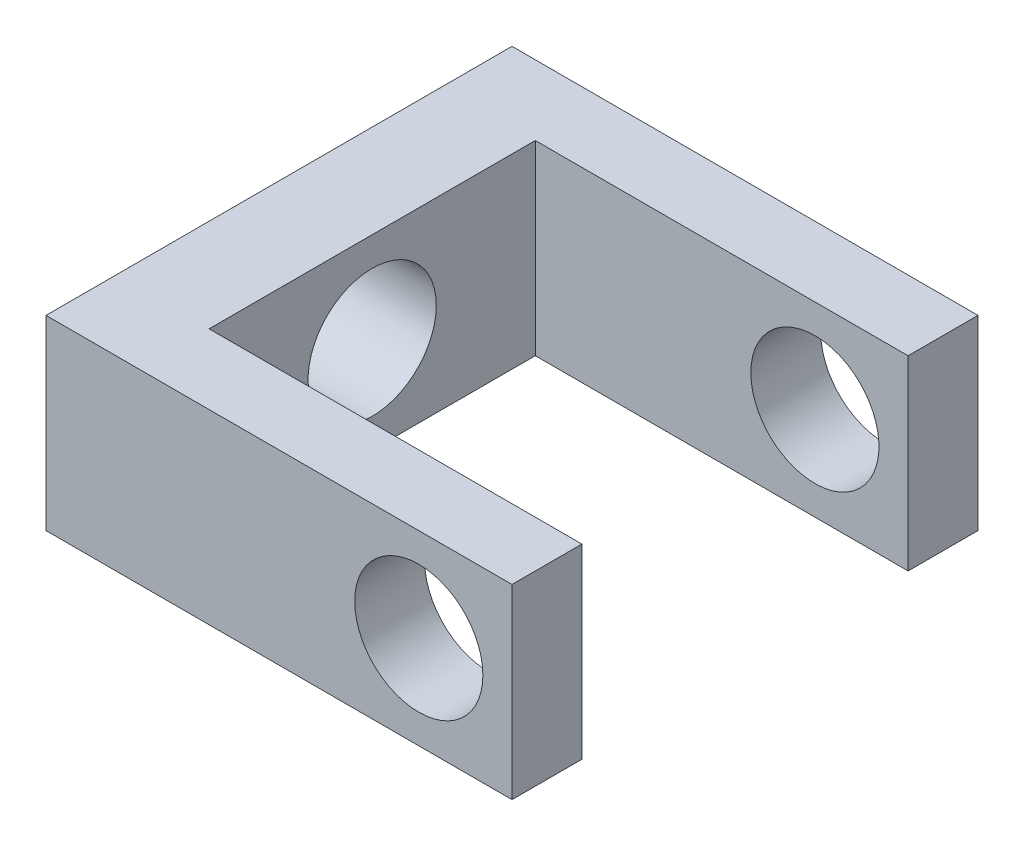
from build123d import *

# Parameters (mm, degrees)
SKETCH1_W           = 20
SKETCH1_H           = 8
SKETCH1_R           = 2.75
BOSS_EXTRUDE1_DEPTH = 20
SKETCH2_W           = 14
SKETCH2_H           = 8
CUT_EXTRUDE1_DEPTH  = 16
SKETCH3_R           = 2.75
CUT_EXTRUDE2_DEPTH  = 26.922962794


with BuildPart() as part:
    # Sketch1 → Boss-Extrude1 (new body)
    with BuildSketch(Plane.XY):
        Rectangle(SKETCH1_W, SKETCH1_H)
        with Locations((6, 0)):
            Circle(SKETCH1_R, mode=Mode.SUBTRACT)
    extrude(amount=BOSS_EXTRUDE1_DEPTH)

    # Sketch2 → Cut-Extrude1 (cut)
    with BuildSketch(Plane(origin=(10, 0, 0), x_dir=(0, 0, -1), z_dir=(1, 0, 0))):
        with Locations((-10, 0)):
            Rectangle(SKETCH2_W, SKETCH2_H)
    extrude(amount=-CUT_EXTRUDE1_DEPTH, mode=Mode.SUBTRACT)

    # Sketch3 → Cut-Extrude2 (cut, through all)
    with BuildSketch(Plane(origin=(-6, 0, 0), x_dir=(0, 0, -1), z_dir=(1, 0, 0))):
        with Locations((-10, 0)):
            Circle(SKETCH3_R)
    extrude(amount=-CUT_EXTRUDE2_DEPTH, mode=Mode.SUBTRACT)


solid = part.part
